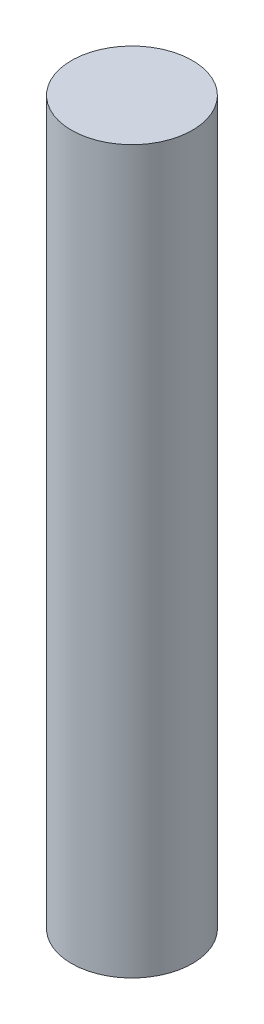
from build123d import *

# Parameters (mm, degrees)
SKETCH1_R           = 1.675
BOSS_EXTRUDE1_DEPTH = 20


with BuildPart() as part:
    # Sketch1 → Boss-Extrude1 (new body)
    with BuildSketch(Plane(origin=(0, 0, 0), x_dir=(1, 0, 0), z_dir=(0, 1, 0))):
        with Locations(Location((0, 0, 0), (0, 0, 270))):
            Circle(SKETCH1_R)
    extrude(amount=BOSS_EXTRUDE1_DEPTH)


solid = part.part
